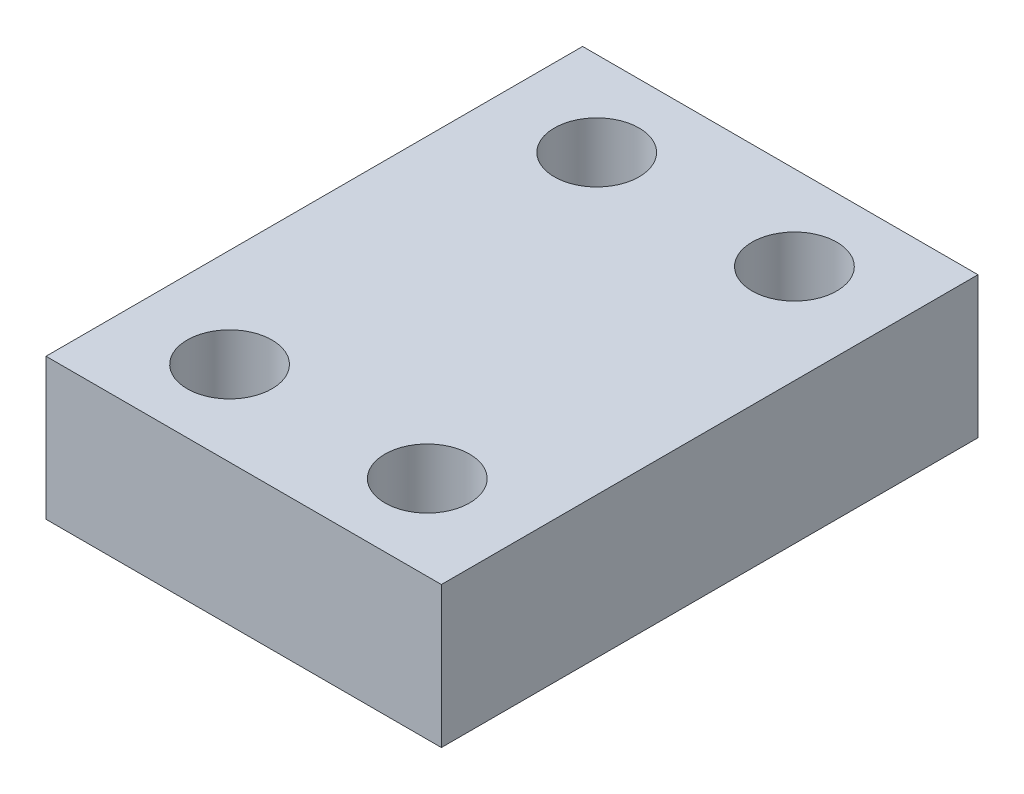
from build123d import *

# Parameters (mm, degrees)
SKETCH_1_W      = 14
SKETCH_1_H      = 19
SKETCH_1_R      = 1.5
EXTRUDE_1_DEPTH = 5


with BuildPart() as part:
    # 草图1 → 凸台-拉伸1 (new body)
    with BuildSketch(Plane(origin=(0, 0, 0), x_dir=(1, 0, 0), z_dir=(0, 1, 0))):
        Rectangle(SKETCH_1_W, SKETCH_1_H)
        with Locations(Location((3.5, 6.5, 0), (0, 0, 270))):
            Circle(SKETCH_1_R, mode=Mode.SUBTRACT)
        with Locations(Location((-3.5, 6.5, 0), (0, 0, 90))):
            Circle(SKETCH_1_R, mode=Mode.SUBTRACT)
        with Locations(Location((-3.5, -6.5, 0), (0, 0, 270))):
            Circle(SKETCH_1_R, mode=Mode.SUBTRACT)
        with Locations(Location((3.5, -6.5, 0), (0, 0, 90))):
            Circle(SKETCH_1_R, mode=Mode.SUBTRACT)
    extrude(amount=EXTRUDE_1_DEPTH)


solid = part.part
